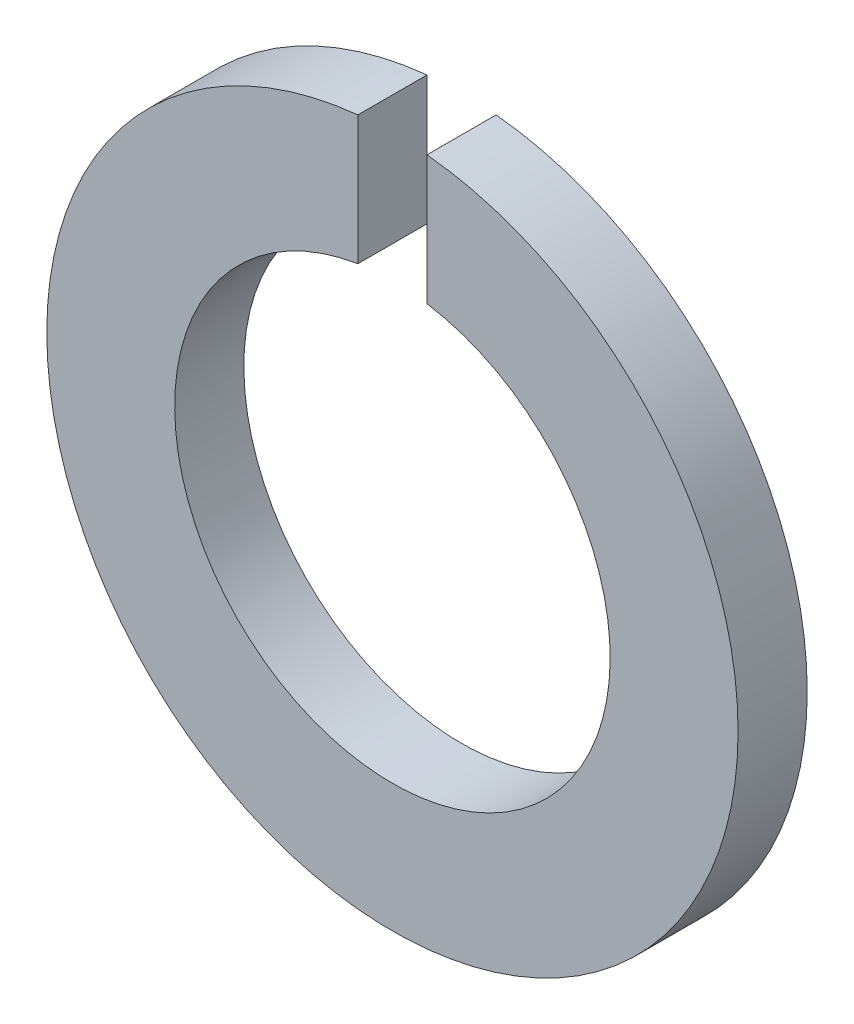
from build123d import *

# Parameters (mm, degrees)
EXTRUDE1_DEPTH = 0.508


with BuildPart() as part:
    # Sketch1 → Extrude1 (new body)
    with BuildSketch(Plane.XY):
        with BuildLine():
            Line((-0.254, 2.52726809), (-0.254, 1.5797101))
            ThreePointArc((-0.254, 1.5797101), (0, -1.6), (0.254, 1.5797101))
            Line((0.254, 1.5797101), (0.254, 2.52726809))
            ThreePointArc((0.254, 2.52726809), (0, -2.54), (-0.254, 2.52726809))
        make_face()
    extrude(amount=EXTRUDE1_DEPTH)


solid = part.part
